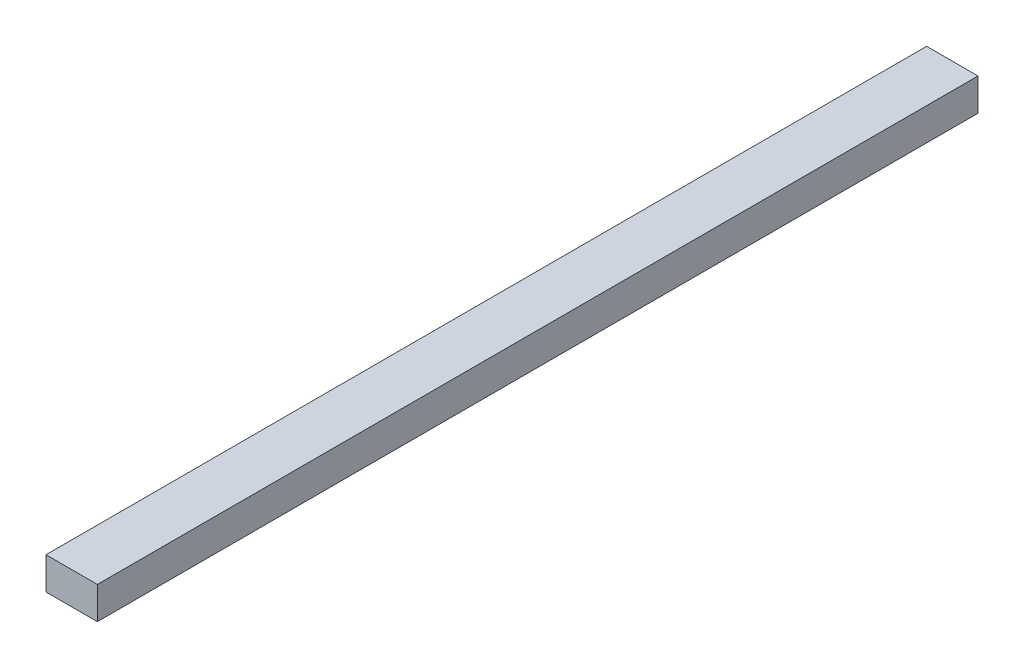
from build123d import *

# Parameters (mm, degrees)
SKETCH1_W           = 70
SKETCH1_H           = 44
BOSS_EXTRUDE1_DEPTH = 600


with BuildPart() as part:
    # Sketch1 → Boss-Extrude1 (new, symmetric)
    with BuildSketch(Plane.XY):
        Rectangle(SKETCH1_W, SKETCH1_H)
    extrude(amount=BOSS_EXTRUDE1_DEPTH, both=True)


solid = part.part
